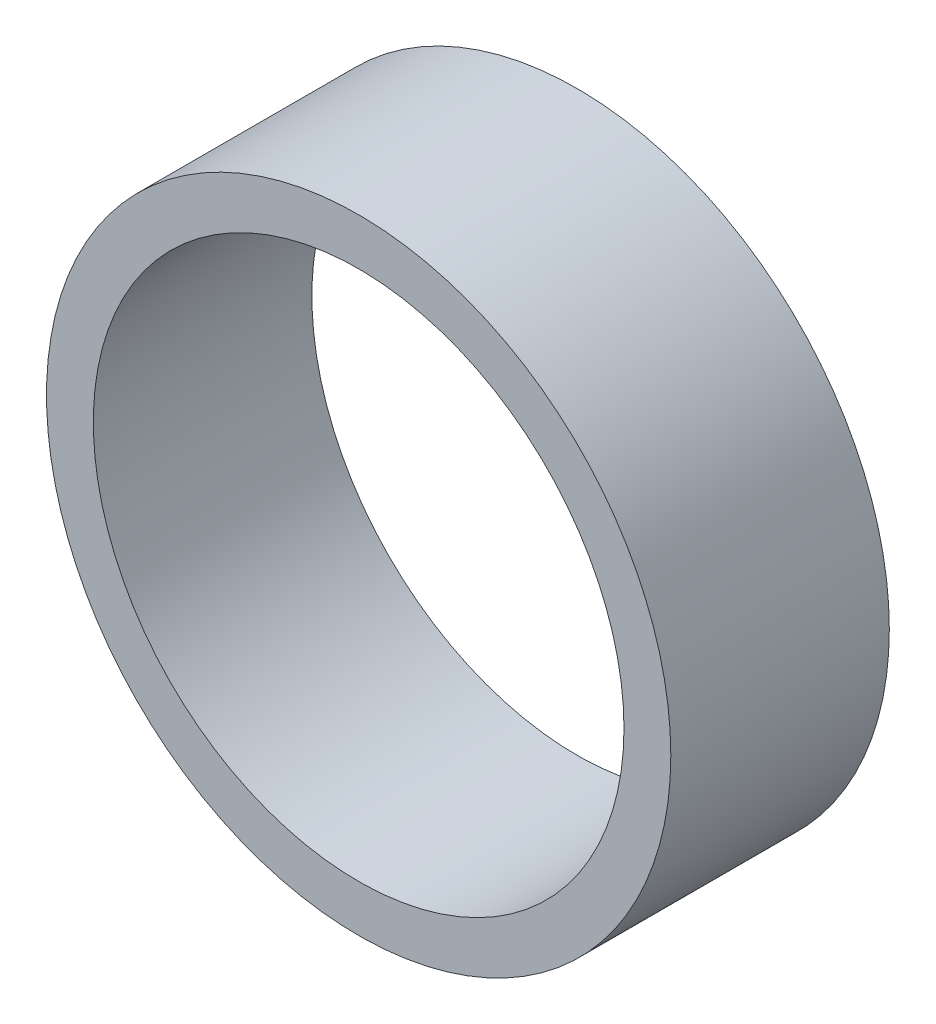
from build123d import *

# Parameters (mm, degrees)
SKETCH1_R           = 10
SKETCH1_R_2         = 8.5
BOSS_EXTRUDE1_DEPTH = 7


with BuildPart() as part:
    # Sketch1 → Boss-Extrude1 (new body)
    with BuildSketch(Plane.XY):
        Circle(SKETCH1_R)
        Circle(SKETCH1_R_2, mode=Mode.SUBTRACT)
    extrude(amount=BOSS_EXTRUDE1_DEPTH)


solid = part.part
